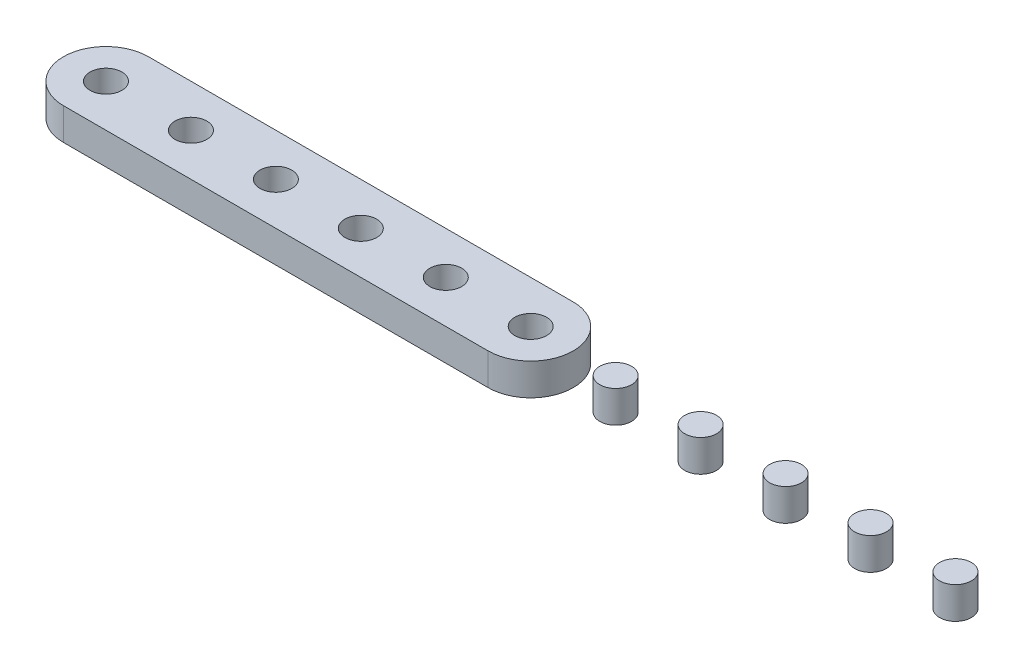
from build123d import *

# Parameters (mm, degrees)
SKETCH2_R             = 1.5
BOSS_EXTRUDE2_DEPTH   = 3
BOSS_EXTRUDE2_2_DEPTH = 3
BOSS_EXTRUDE2_3_DEPTH = 3
BOSS_EXTRUDE2_4_DEPTH = 3
BOSS_EXTRUDE2_5_DEPTH = 3
BOSS_EXTRUDE2_6_DEPTH = 3


with BuildPart() as part:
    # Sketch2 → Boss-Extrude2 (new body)
    with BuildSketch(Plane(origin=(0, 0, 0), x_dir=(1, 0, 0), z_dir=(0, 1, 0))):
        with Locations(Location((48, 0, 0), (0, 0, 270))):
            Circle(SKETCH2_R)
    extrude(amount=BOSS_EXTRUDE2_DEPTH)


with BuildPart() as body_2:
    # Sketch2 → Boss-Extrude2 2 (new body)
    with BuildSketch(Plane(origin=(0, 0, 0), x_dir=(1, 0, 0), z_dir=(0, 1, 0))):
        with Locations(Location((56, 0, 0), (0, 0, 270))):
            Circle(SKETCH2_R)
    extrude(amount=BOSS_EXTRUDE2_2_DEPTH)


with BuildPart() as body_3:
    # Sketch2 → Boss-Extrude2 3 (new body)
    with BuildSketch(Plane(origin=(0, 0, 0), x_dir=(1, 0, 0), z_dir=(0, 1, 0))):
        with Locations(Location((64, 0, 0), (0, 0, 270))):
            Circle(SKETCH2_R)
    extrude(amount=BOSS_EXTRUDE2_3_DEPTH)


with BuildPart() as body_4:
    # Sketch2 → Boss-Extrude2 4 (new body)
    with BuildSketch(Plane(origin=(0, 0, 0), x_dir=(1, 0, 0), z_dir=(0, 1, 0))):
        with Locations(Location((72, 0, 0), (0, 0, 270))):
            Circle(SKETCH2_R)
    extrude(amount=BOSS_EXTRUDE2_4_DEPTH)


with BuildPart() as body_5:
    # Sketch2 → Boss-Extrude2 5 (new body)
    with BuildSketch(Plane(origin=(0, 0, 0), x_dir=(1, 0, 0), z_dir=(0, 1, 0))):
        with Locations(Location((80, 0, 0), (0, 0, 270))):
            Circle(SKETCH2_R)
    extrude(amount=BOSS_EXTRUDE2_5_DEPTH)


with BuildPart() as body_6:
    # Sketch2 → Boss-Extrude2 6 (new body)
    with BuildSketch(Plane(origin=(0, 0, 0), x_dir=(1, 0, 0), z_dir=(0, 1, 0))):
        with BuildLine():
            Line((0, 4), (40, 4))
            ThreePointArc((40, 4), (44, 0), (40, -4))
            Line((40, -4), (0, -4))
            ThreePointArc((0, -4), (-4, 0), (0, 4))
        make_face()
        with Locations(Location((0, 0, 0), (0, 0, 270))):
            Circle(SKETCH2_R, mode=Mode.SUBTRACT)
        with Locations(Location((8, 0, 0), (0, 0, 270))):
            Circle(SKETCH2_R, mode=Mode.SUBTRACT)
        with Locations(Location((16, 0, 0), (0, 0, 270))):
            Circle(SKETCH2_R, mode=Mode.SUBTRACT)
        with Locations(Location((24, 0, 0), (0, 0, 270))):
            Circle(SKETCH2_R, mode=Mode.SUBTRACT)
        with Locations(Location((32, 0, 0), (0, 0, 270))):
            Circle(SKETCH2_R, mode=Mode.SUBTRACT)
        with Locations(Location((40, 0, 0), (0, 0, 270))):
            Circle(SKETCH2_R, mode=Mode.SUBTRACT)
    extrude(amount=BOSS_EXTRUDE2_6_DEPTH)


solid = Compound([part.part, body_2.part, body_3.part, body_4.part, body_5.part, body_6.part])
